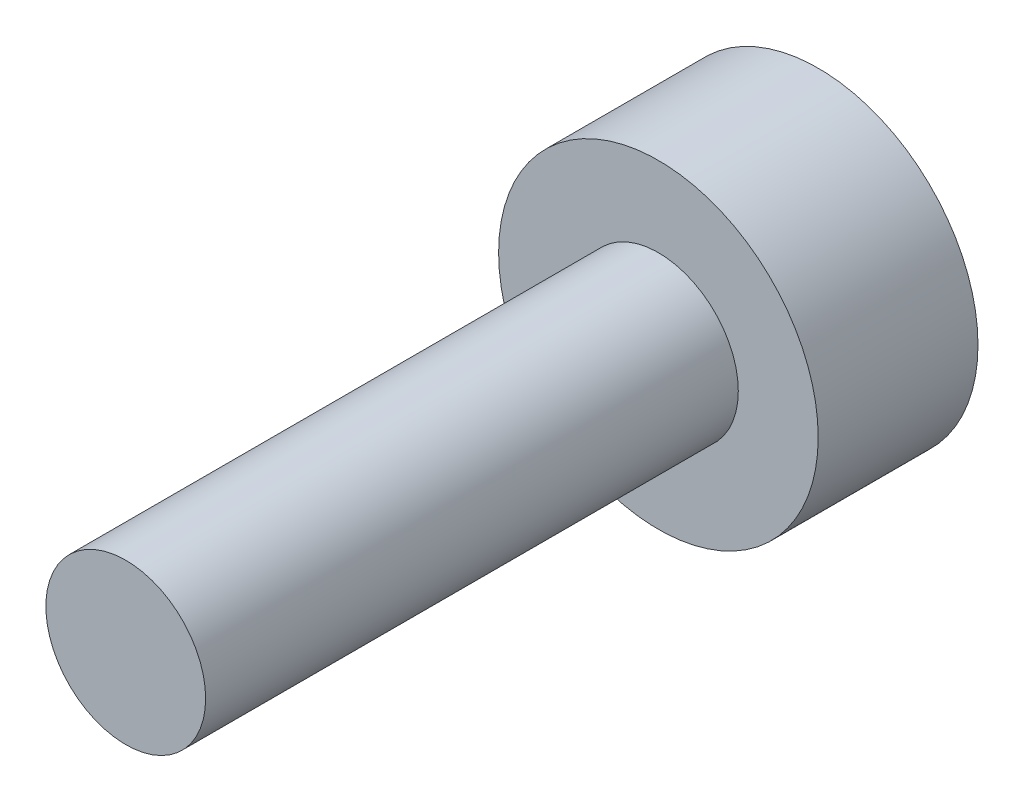
from build123d import *

# Parameters (mm, degrees)
SKETCH_1_R      = 3
EXTRUDE_1_DEPTH = 3
SKETCH_2_R      = 1.5
EXTRUDE_2_DEPTH = 10


with BuildPart() as part:
    # 草图1 → 凸台-拉伸1 (new body)
    with BuildSketch(Plane.XY):
        Circle(SKETCH_1_R)
    extrude(amount=EXTRUDE_1_DEPTH)

    # 草图2 → 凸台-拉伸2 (add)
    with BuildSketch(Plane.XY.offset(3)):
        Circle(SKETCH_2_R)
    extrude(amount=EXTRUDE_2_DEPTH)


solid = part.part
